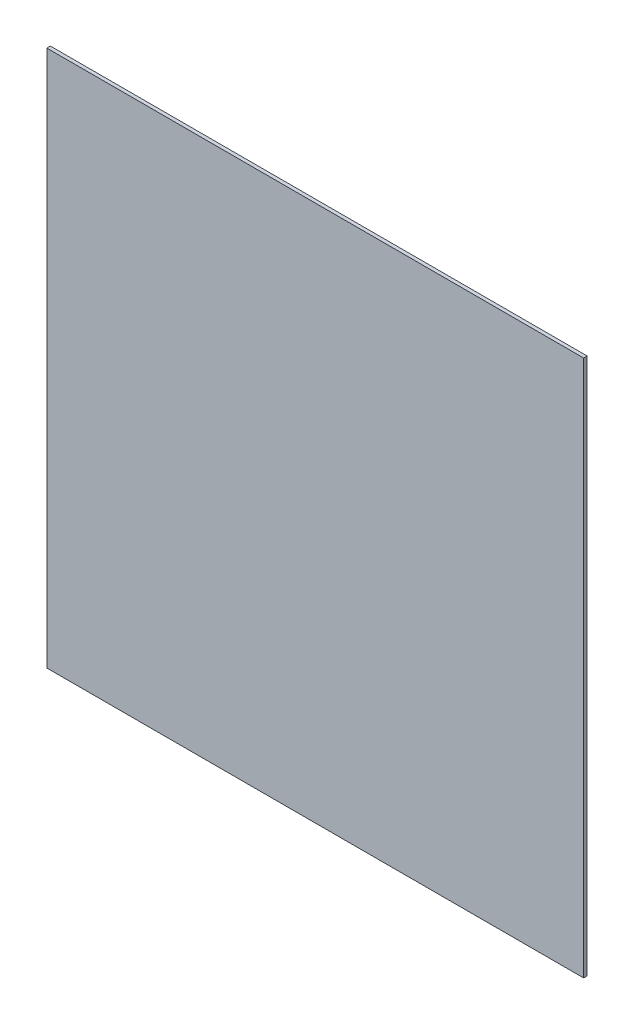
from build123d import *

# Parameters (mm, degrees)
SKETCH_1_W      = 1525
SKETCH_1_H      = 1525
EXTRUDE_1_DEPTH = 10


with BuildPart() as part:
    # Эскиз1 → Бобышка-Вытянуть1 (new body)
    with BuildSketch(Plane.XY):
        with Locations((-739.419116479, 746.550850151)):
            Rectangle(SKETCH_1_W, SKETCH_1_H)
    extrude(amount=EXTRUDE_1_DEPTH)


solid = part.part
